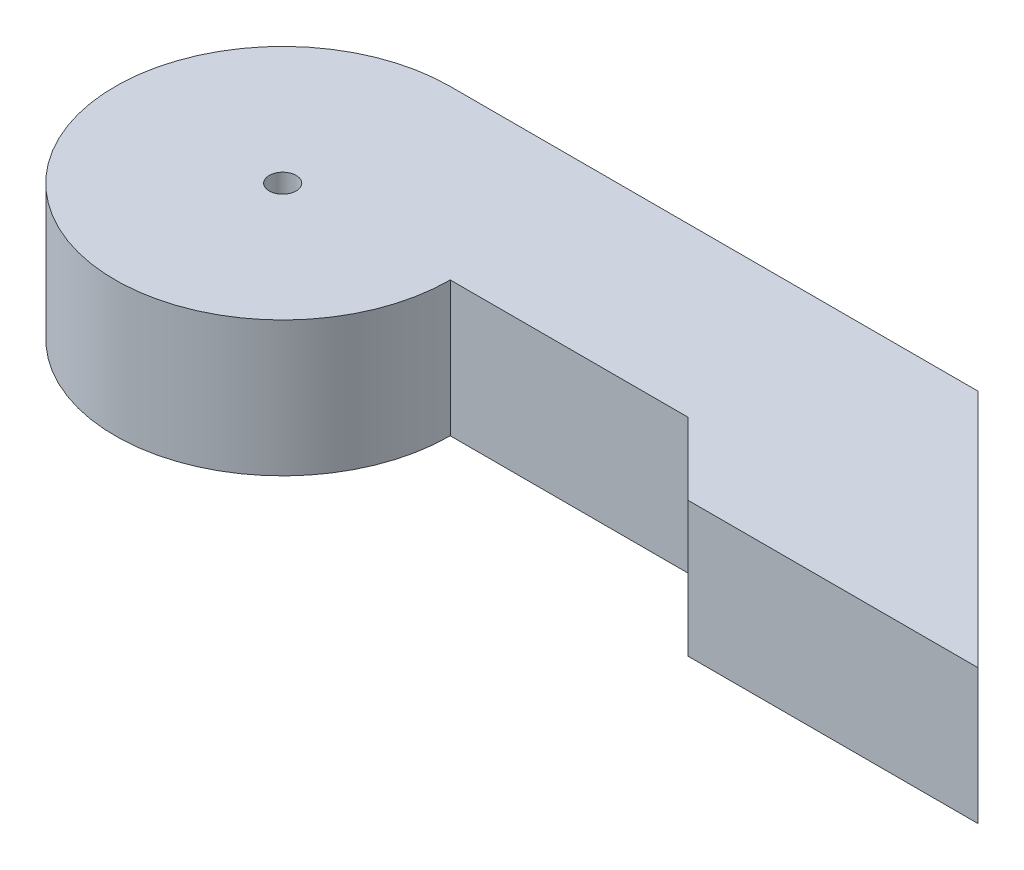
from build123d import *

# Parameters (mm, degrees)
BOSS_EXTRUDE2_DEPTH = 10


with BuildPart() as part:
    # Sketch1 → Boss-Extrude2 (new body)
    with BuildSketch(Plane(origin=(0, 0, 0), x_dir=(1, 0, 0), z_dir=(0, 1, 0))):
        with BuildLine():
            ThreePointArc((12.410397071, 0), (8.775475926, 8.775475926), (0, 12.410397071))
            Line((0, 12.410397071), (0, 1))
            ThreePointArc((0, 1), (0.707106781, 0.707106781), (1, 0))
            Line((1, 0), (12.410397071, 0))
        make_face()
        with BuildLine():
            Line((0, 1), (0, 12.410397071))
            ThreePointArc((0, 12.410397071), (-8.775475926, -8.775475926), (12.410397071, 0))
            Line((12.410397071, 0), (1, 0))
            ThreePointArc((1, 0), (-0.707106781, -0.707106781), (0, 1))
        make_face()
        with BuildLine():
            Line((30.017427339, 12.410397071), (0, 12.410397071))
            ThreePointArc((0, 12.410397071), (8.775475926, 8.775475926), (12.410397071, 0))
            Line((12.410397071, 0), (30.017427339, 0))
            Line((30.017427339, 0), (30.017427339, 12.410397071))
        make_face()
        Polygon((30.017427339, 0), (30.017427339, 12.410397071), (39.086451676, 12.410397071), (56.824436842, -5.327588094), (35.345015433, -5.327588094), align=None)
    extrude(amount=BOSS_EXTRUDE2_DEPTH)


solid = part.part
